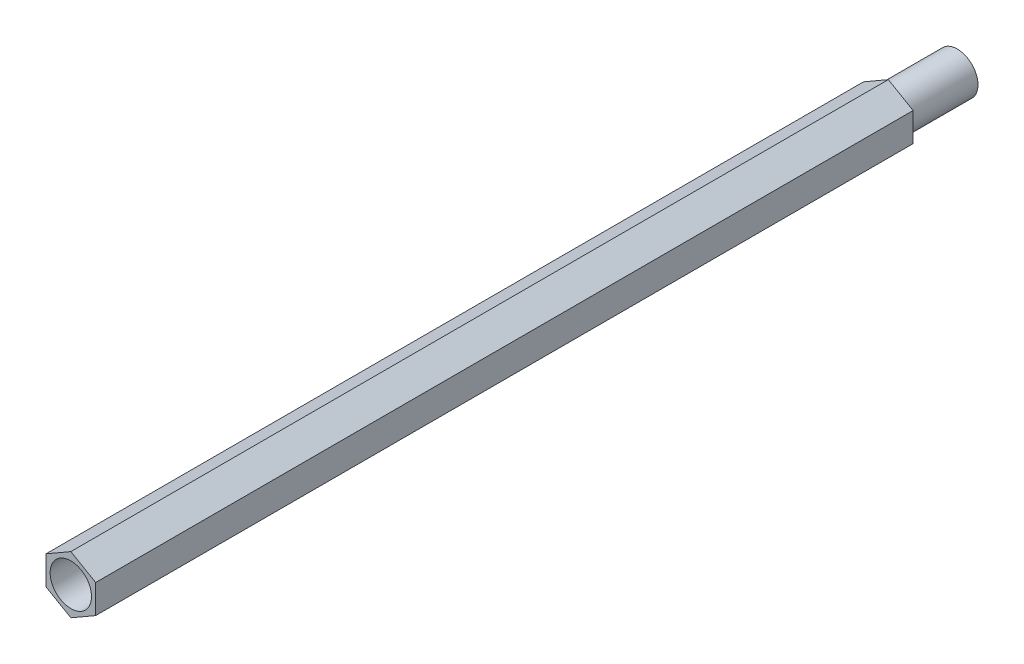
from build123d import *

# Parameters (mm, degrees)
SKETCH_1_R      = 1.5
EXTRUDE_1_DEPTH = 59.25
SKETCH_2_R      = 1.5
EXTRUDE_2_DEPTH = 5


with BuildPart() as part:
    # 草图1 → 凸台-拉伸1 (new body)
    with BuildSketch(Plane.XY):
        Polygon((0, 2.078460969), (-1.8, 1.039230485), (-1.8, -1.039230485), (0, -2.078460969), (1.8, -1.039230485), (1.8, 1.039230485), align=None)
        Circle(SKETCH_1_R, mode=Mode.SUBTRACT)
    extrude(amount=EXTRUDE_1_DEPTH)

    # 草图2 → 凸台-拉伸2 (add, symmetric)
    with BuildSketch(Plane(origin=(0, 0, 0), x_dir=(-1, 0, 0), z_dir=(0, 0, -1))):
        Circle(SKETCH_2_R)
    extrude(amount=EXTRUDE_2_DEPTH, both=True)


solid = part.part
